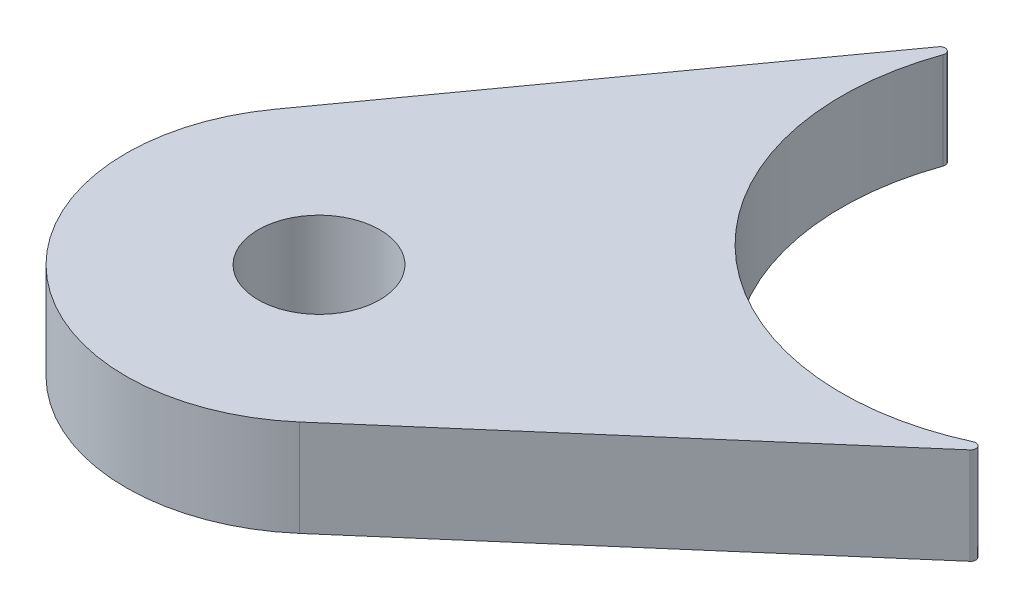
from build123d import *

# Parameters (mm, degrees)
SKETCH1_R           = 3
BOSS_EXTRUDE1_DEPTH = 4.7625
FILLET1_R           = 0.254


with BuildPart() as part:
    # Sketch1 → Boss-Extrude1 (new body)
    with BuildSketch(Plane(origin=(0, 0, 0), x_dir=(1, 0, 0), z_dir=(0, 1, 0))):
        with BuildLine():
            Line((-26.112582247, -14.5455091), (-10.30861167, 7.417716997))
            ThreePointArc((-10.30861167, 7.417716997), (-8.568537347, -9.373908882), (8.311458659, -9.602585848))
            Line((8.311458659, -9.602585848), (-12.1475295, -27.310736233))
            ThreePointArc((-12.1475295, -27.310736233), (-24.807526504, -27.139228509), (-26.112582247, -14.5455091))
        make_face()
        with Locations(Location((-18.381123494, -20.108796847, 0), (0, 0, 90))):
            Circle(SKETCH1_R, mode=Mode.SUBTRACT)
    extrude(amount=BOSS_EXTRUDE1_DEPTH)

    # Fillet1
    fillet1_edges = [part.edges().sort_by_distance(p)[0] for p in [
        (-10.30861167, 2.38125, -7.417716997),
        (8.311458659, 2.38125, 9.602585848),
    ]]
    fillet(fillet1_edges, radius=FILLET1_R)


solid = part.part
